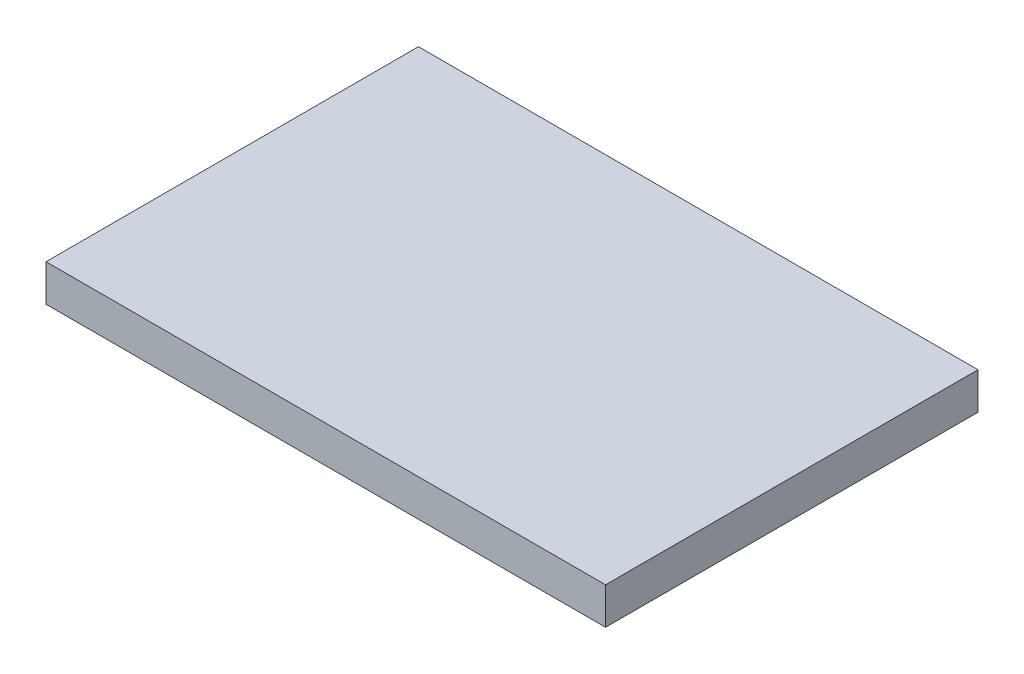
from build123d import *

# Parameters (mm, degrees)
SKETCH1_W           = 47.85
SKETCH1_H           = 31.85
BOSS_EXTRUDE1_DEPTH = 3.15
SHELL1_T            = -1.5


with BuildPart() as part:
    # Sketch1 → Boss-Extrude1 (new body)
    with BuildSketch(Plane(origin=(0, 0, 0), x_dir=(1, 0, 0), z_dir=(0, 1, 0))):
        Rectangle(SKETCH1_W, SKETCH1_H)
    extrude(amount=-BOSS_EXTRUDE1_DEPTH)

    # Shell1
    shell1_openings = [part.faces().sort_by_distance(p)[0] for p in [
        (0, -3.15, 0),
    ]]
    offset(amount=SHELL1_T, openings=shell1_openings, kind=Kind.INTERSECTION)


solid = part.part
